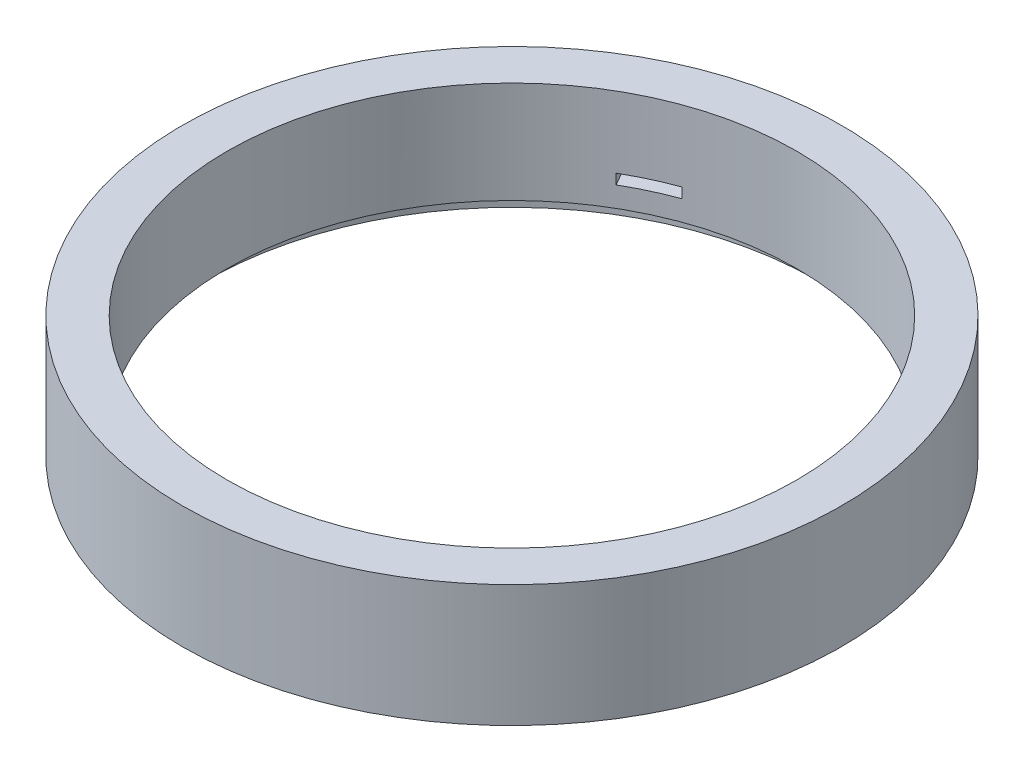
from build123d import *

# Parameters (mm, degrees)
SKETCH_1_R               = 81
SKETCH_1_R_2             = 70
EXTRUDE_1_DEPTH          = 15
SKETCH_2_W               = 5
SKETCH_2_H               = 2.5
CUT_REVOLVE_1_ANGLE      = 10
PATTERN_CIRCULAR_1_COUNT = 3
SKETCH_3_R               = 75
CUT_EXTRUDE_1_DEPTH      = 5


with BuildPart() as part:
    # 草圖1 → 填料-伸長1 (new, symmetric)
    with BuildSketch(Plane(origin=(0, 0, 0), x_dir=(1, 0, 0), z_dir=(0, 1, 0))):
        with Locations(Location((0, 0, 0), (0, 0, 270))):
            Circle(SKETCH_1_R)
        with Locations(Location((0, 0, 0), (0, 0, 270))):
            Circle(SKETCH_1_R_2, mode=Mode.SUBTRACT)
    extrude(amount=EXTRUDE_1_DEPTH, both=True)

    # 草圖2 → 除料-旋轉1 (revolve, cut)
    with BuildSketch(Plane.XY):
        with Locations((72.498409613, -3.75)):
            Rectangle(SKETCH_2_W, SKETCH_2_H)
    cut_revolve_1 = revolve(axis=Axis((0, 15, 0), (0, -1, 0)), revolution_arc=CUT_REVOLVE_1_ANGLE, mode=Mode.SUBTRACT)

    # 環狀複製排列1: 除料-旋轉1 ×3 about axis
    pattern_circular_1_axis = Axis((0, 0, 0), (0, 1, 0))
    for i in range(1, PATTERN_CIRCULAR_1_COUNT):
        add(cut_revolve_1.rotate(pattern_circular_1_axis, i * 360 / PATTERN_CIRCULAR_1_COUNT), mode=Mode.SUBTRACT)

    # 草圖3 → 除料-伸長1 (cut)
    with BuildSketch(Plane.XZ.offset(15)):
        with Locations(Location((0, 0, 0), (0, 0, 270))):
            Circle(SKETCH_3_R)
    extrude(amount=-CUT_EXTRUDE_1_DEPTH, mode=Mode.SUBTRACT)


solid = part.part
